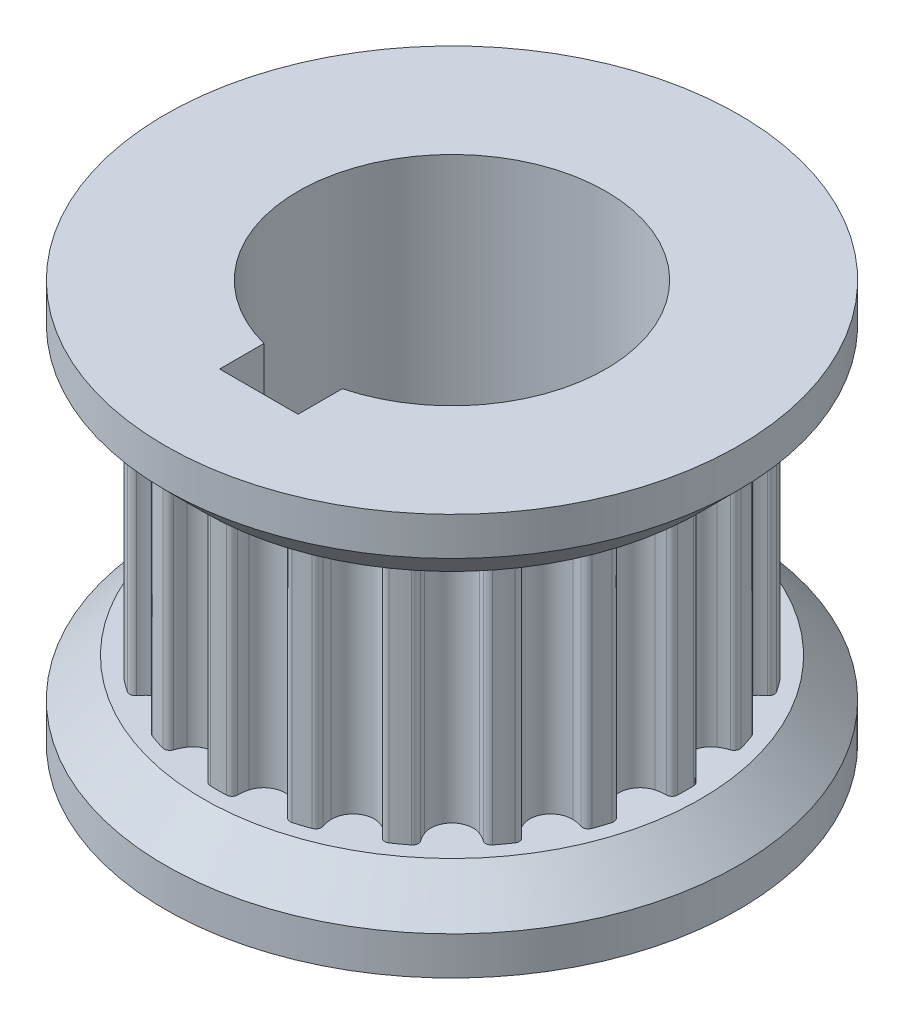
from build123d import *

# Parameters (mm, degrees)
SKETCH1_R           = 5.362197731
BOSS_EXTRUDE1_DEPTH = 3.25
BOSS_EXTRUDE2_DEPTH = 3.25
CIRPATTERN1_COUNT   = 20
SKETCH2_R           = 7.5
BOSS_EXTRUDE4_DEPTH = 2
BOSS_EXTRUDE5_START = 2
SKETCH3_R           = 7.5
BOSS_EXTRUDE5_DEPTH = 2
CHAMFER1_SIZE       = 1
CUT_EXTRUDE1_DEPTH  = 15.924811557


with BuildPart() as part:
    # Sketch1 → Boss-Extrude1 (new, symmetric)
    with BuildSketch(Plane(origin=(0, 0, 0), x_dir=(1, 0, 0), z_dir=(0, 1, 0))):
        Circle(SKETCH1_R)
    extrude(amount=BOSS_EXTRUDE1_DEPTH, both=True)

    # Sketch1<5> → Boss-Extrude2 (add, symmetric)
    with BuildSketch(Plane(origin=(0, 0, 0), x_dir=(1, 0, 0), z_dir=(0, 1, 0))):
        with BuildLine():
            ThreePointArc((0.389735662, 5.700066587), (0.554530956, 5.43168156), (0.838832533, 5.296180179))
            ThreePointArc((0.838832533, 5.296180179), (0, 5.362197731), (-0.838832533, 5.296180179))
            ThreePointArc((-0.838832533, 5.296180179), (-0.554530956, 5.43168156), (-0.389735662, 5.700066587))
            ThreePointArc((-0.389735662, 5.700066587), (-0.364064796, 5.828326126), (-0.35535439, 5.958839083))
            ThreePointArc((-0.35535439, 5.958839083), (-0.313169487, 6.062947912), (-0.21052091, 6.108571195))
            ThreePointArc((-0.21052091, 6.108571195), (0, 6.112197731), (0.21052091, 6.108571195))
            ThreePointArc((0.21052091, 6.108571195), (0.313169487, 6.062947912), (0.35535439, 5.958839083))
            ThreePointArc((0.35535439, 5.958839083), (0.364064796, 5.828326126), (0.389735662, 5.700066587))
        make_face()
    boss_extrude2 = extrude(amount=BOSS_EXTRUDE2_DEPTH, both=True)

    # CirPattern1: Boss-Extrude2 ×20 about axis
    cirpattern1_axis = Axis((0, -3.25, 0), (0, 1, 0))
    for i in range(1, CIRPATTERN1_COUNT):
        add(boss_extrude2.rotate(cirpattern1_axis, i * 360 / CIRPATTERN1_COUNT))

    # Sketch2 → Boss-Extrude4 (add)
    with BuildSketch(Plane(origin=(0, 3.25, 0), x_dir=(1, 0, 0), z_dir=(0, 1, 0))):
        Circle(SKETCH2_R)
    extrude(amount=BOSS_EXTRUDE4_DEPTH)

    # Sketch3 → Boss-Extrude5 (add)
    with BuildSketch(Plane.XZ.offset(3.25).offset(BOSS_EXTRUDE5_START)):
        Circle(SKETCH3_R)
    extrude(amount=-BOSS_EXTRUDE5_DEPTH)

    # Chamfer1
    chamfer1_edges = [part.edges().sort_by_distance(p)[0] for p in [
        (-7.5, -3.25, 0),
        (-7.5, 3.25, 0),
    ]]
    chamfer(chamfer1_edges, length=CHAMFER1_SIZE)

    # Sketch4 → Cut-Extrude1 (cut, through all)
    with BuildSketch(Plane.XZ.offset(5.25)):
        with BuildLine():
            Line((1.025, 5.05), (-1.025, 5.05))
            Line((-1.025, 5.05), (-1.025, 3.892300091))
            ThreePointArc((-1.025, 3.892300091), (0, -4.025), (1.025, 3.892300091))
            Line((1.025, 3.892300091), (1.025, 5.05))
        make_face()
    extrude(amount=-CUT_EXTRUDE1_DEPTH, mode=Mode.SUBTRACT)


solid = part.part
